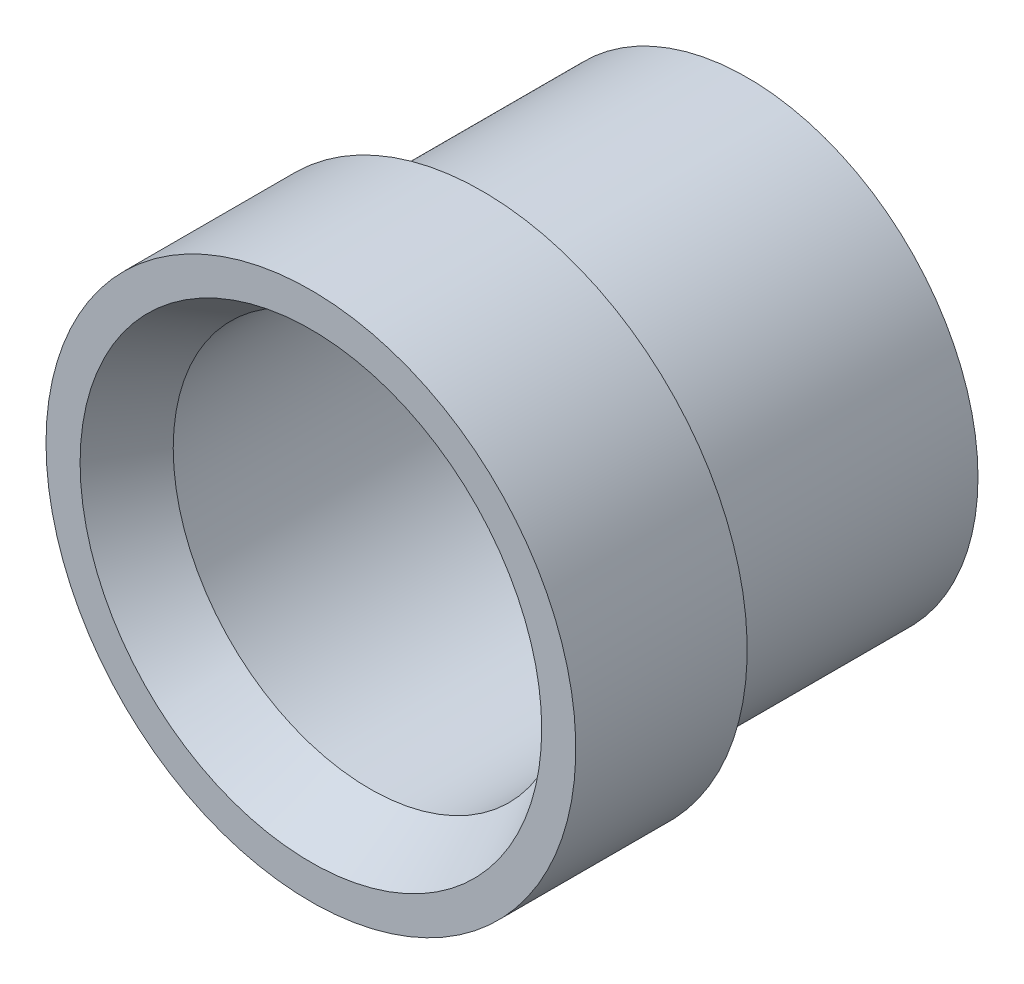
from build123d import *


with BuildPart() as part:
    # Sketch1 → Revolve1 (revolve)
    with BuildSketch(Plane(origin=(0, 0, 0), x_dir=(0, 0, -1), z_dir=(1, 0, 0)), mode=Mode.PRIVATE) as revolve1_sk:
        Polygon((-7.112, 7.52475), (-5.18725854, 6.4135), (7.112, 6.4135), (7.112, 7.52475), (-1.524, 7.52475), (-1.524, 8.636), (-7.112, 8.636), align=None)
    revolve(revolve1_sk.sketch.rotate(Axis((0, 0, -7.112), (0, 0, 1)), 90), axis=Axis((0, 0, -7.112), (0, 0, 1)))


solid = part.part
